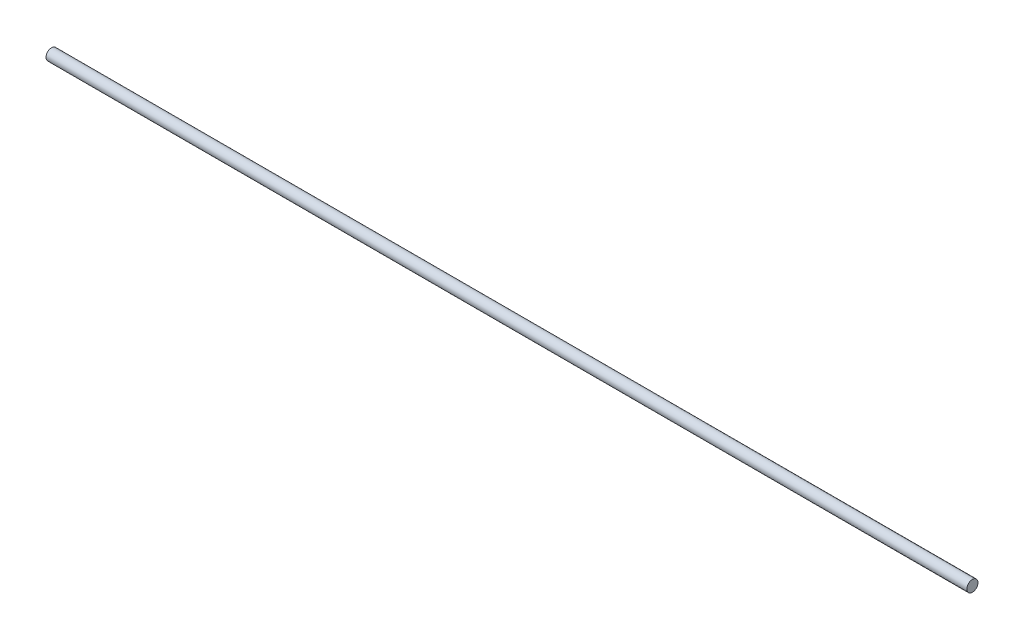
from build123d import *

# Parameters (mm, degrees)
SKETCH2_R           = 1.2
BOSS_EXTRUDE1_DEPTH = 198.12


with BuildPart() as part:
    # Sketch2 → Boss-Extrude1 (new body)
    with BuildSketch(Plane(origin=(0, 0, 0), x_dir=(0, 0, -1), z_dir=(1, 0, 0))):
        Circle(SKETCH2_R)
    extrude(amount=BOSS_EXTRUDE1_DEPTH)


solid = part.part
